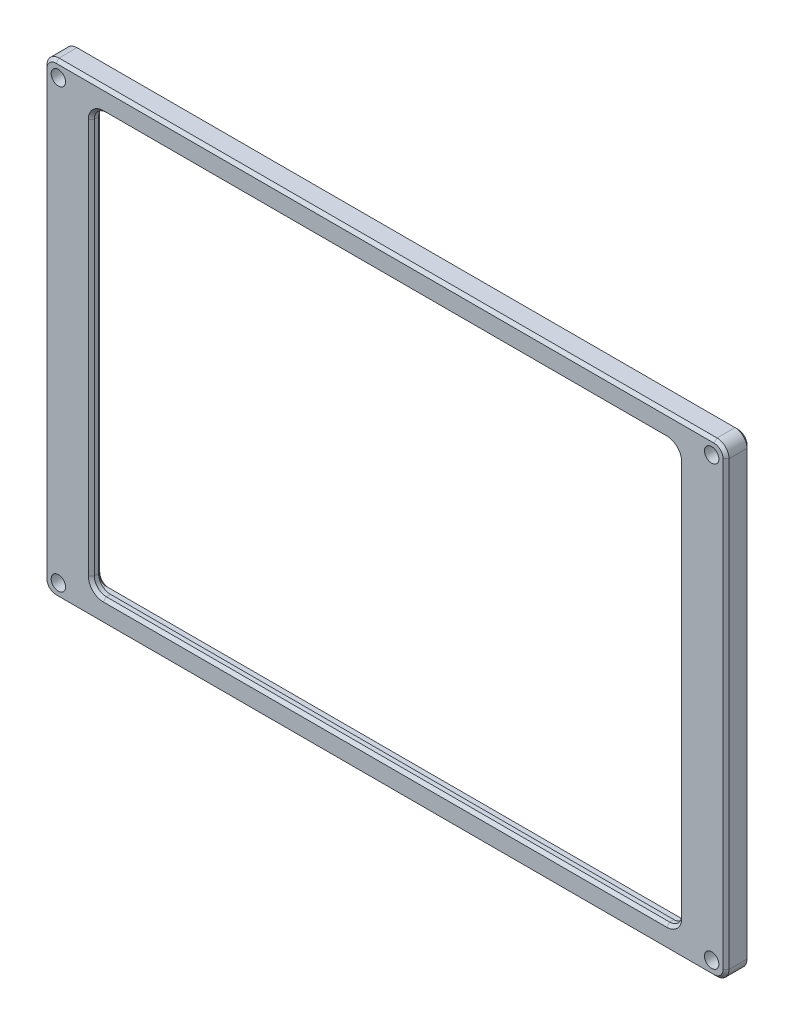
from build123d import *

# Parameters (mm, degrees)
SKETCH1_W                = 113.8
SKETCH1_H                = 77.8
SKETCH1_W_2              = 98
SKETCH1_H_2              = 70
BOSS_EXTRUDE1_DEPTH      = 4
M2_CLEARANCE_HOLE1_D     = 2.4
M2_CLEARANCE_HOLE1_DEPTH = 4
FILLET1_R                = 2
FILLET2_R                = 2
SKETCH5_W                = 102.2
SKETCH5_H                = 73
CUT_EXTRUDE2_DEPTH       = 2.8
FILLET5_R                = 1
CHAMFER1_SIZE            = 0.5


with BuildPart() as part:
    # Sketch1 → Boss-Extrude1 (new body)
    with BuildSketch(Plane.XY):
        Rectangle(SKETCH1_W, SKETCH1_H)
        Rectangle(SKETCH1_W_2, SKETCH1_H_2, mode=Mode.SUBTRACT)
    extrude(amount=BOSS_EXTRUDE1_DEPTH)

    # M2 Clearance Hole1
    with Locations(Plane.XY.offset(4)):
        with Locations((0, 0), (54.5, 36.5), (-54.5, -36.5), (-54.5, 36.5), (54.5, -36.5)):
            Hole(M2_CLEARANCE_HOLE1_D / 2, depth=M2_CLEARANCE_HOLE1_DEPTH)

    # Fillet1
    fillet1_edges = [part.edges().sort_by_distance(p)[0] for p in [
        (56.9, -38.9, 2),
        (-56.9, -38.9, 2),
        (-56.9, 38.9, 2),
        (56.9, 38.9, 2),
    ]]
    fillet(fillet1_edges, radius=FILLET1_R)

    # Fillet2
    fillet2_edges = [part.edges().sort_by_distance(p)[0] for p in [
        (49, -35, 2),
        (49, 35, 2),
        (-49, 35, 2),
        (-49, -35, 2),
    ]]
    fillet(fillet2_edges, radius=FILLET2_R)

    # Sketch5 → Cut-Extrude2 (cut)
    with BuildSketch(Plane(origin=(0, 0, 0), x_dir=(-1, 0, 0), z_dir=(0, 0, -1))):
        Rectangle(SKETCH5_W, SKETCH5_H)
    extrude(amount=-CUT_EXTRUDE2_DEPTH, mode=Mode.SUBTRACT)

    # Fillet5
    fillet5_edges = [part.edges().sort_by_distance(p)[0] for p in [
        (-51.1, 36.5, 1.4),
        (-51.1, -36.5, 1.4),
        (51.1, -36.5, 1.4),
        (51.1, 36.5, 1.4),
    ]]
    fillet(fillet5_edges, radius=FILLET5_R)

    # Chamfer1
    chamfer1_edges = [part.edges().sort_by_distance(p)[0] for p in [
        (0, -36.5, 0),
        (51.1, 0, 0),
        (0, 36.5, 0),
        (-51.1, 0, 0),
        (50.807106781, -36.207106781, 0),
        (-50.807106781, 36.207106781, 0),
        (-50.807106781, -36.207106781, 0),
        (50.807106781, 36.207106781, 0),
        (56.9, 0, 0),
        (56.9, 0, 4),
        (0, -38.9, 0),
        (-56.9, 0, 0),
        (0, 38.9, 0),
        (-56.314213562, 38.314213562, 0),
        (56.314213562, 38.314213562, 0),
        (-56.314213562, -38.314213562, 0),
        (56.314213562, -38.314213562, 0),
        (0, -38.9, 4),
        (0, 38.9, 4),
        (-56.9, 0, 4),
        (-56.314213562, 38.314213562, 4),
        (56.314213562, 38.314213562, 4),
        (-56.314213562, -38.314213562, 4),
        (56.314213562, -38.314213562, 4),
        (49, 0, 4),
        (0, 35, 4),
        (-49, 0, 4),
        (0, -35, 4),
        (48.414213562, 34.414213562, 4),
        (-48.414213562, -34.414213562, 4),
        (48.414213562, -34.414213562, 4),
        (-48.414213562, 34.414213562, 4),
    ]]
    chamfer(chamfer1_edges, length=CHAMFER1_SIZE)


solid = part.part
